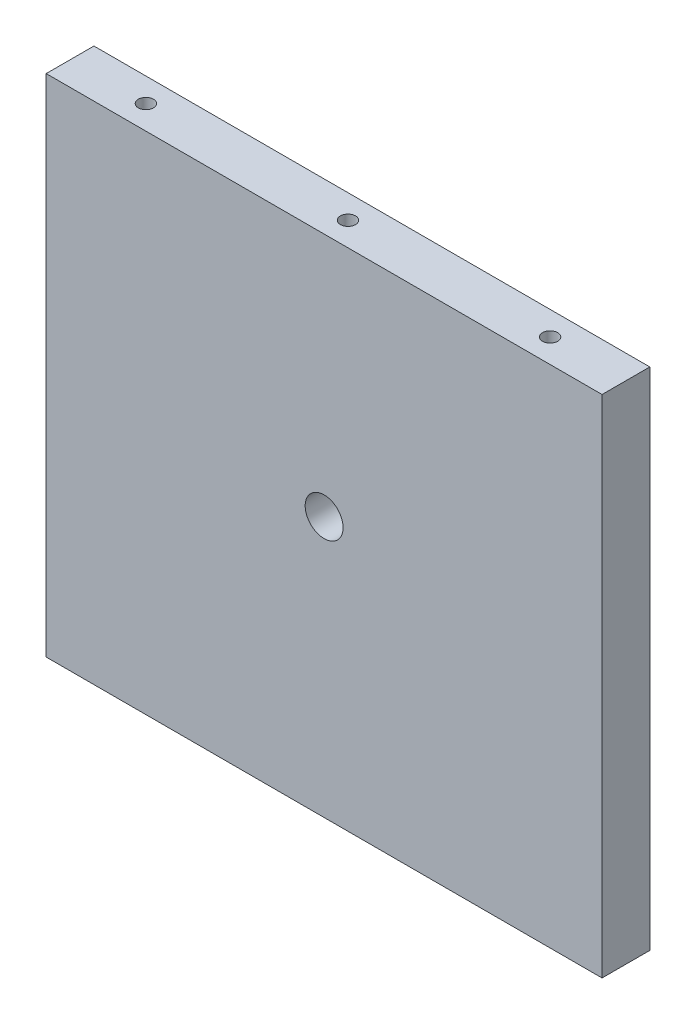
from build123d import *

# Parameters (mm, degrees)
SKETCH1_W                           = 139.7
SKETCH1_H                           = 127
SKETCH1_R                           = 4.7625
BOSS_EXTRUDE1_DEPTH                 = 12
TAP_DRILL_FOR_10_24_TAP1_AT_2_COUNT = 2
TAP_DRILL_FOR_10_24_TAP1_AT_2_PITCH = 50.8
TAP_DRILL_FOR_10_24_TAP1_AT_3_COUNT = 2
TAP_DRILL_FOR_10_24_TAP1_AT_3_PITCH = 101.6


with BuildPart() as part:
    # Sketch1 → Boss-Extrude1 (new body)
    with BuildSketch(Plane.XY):
        with Locations((0, 12.7)):
            Rectangle(SKETCH1_W, SKETCH1_H)
        with Locations((0, 14.67)):
            Circle(SKETCH1_R, mode=Mode.SUBTRACT)
    extrude(amount=BOSS_EXTRUDE1_DEPTH)

    # Sketch4 → Tap Drill for #10-24 Tap1 (revolve, cut)
    with BuildSketch(Plane(origin=(50.8, -50.8, 6), x_dir=(0, 0, -1), z_dir=(1, 0, 0))):
        Polygon((0, 0), (0, 13.840824014), (1.89865, 12.7), (1.89865, 0), align=None)
    tap_drill_for_10_24_tap1 = revolve(axis=Axis((50.8, -57.15, 6), (0, 1, 0)), mode=Mode.SUBTRACT)

    # Tap Drill for #10-24 Tap1 at 2: Tap Drill for #10-24 Tap1 ×2
    with Locations(*[(-i * TAP_DRILL_FOR_10_24_TAP1_AT_2_PITCH, 0, 0) for i in range(1, TAP_DRILL_FOR_10_24_TAP1_AT_2_COUNT)]):
        add(tap_drill_for_10_24_tap1, mode=Mode.SUBTRACT)

    # Tap Drill for #10-24 Tap1 at 3: Tap Drill for #10-24 Tap1 ×2
    with Locations(*[(-i * TAP_DRILL_FOR_10_24_TAP1_AT_3_PITCH, 0, 0) for i in range(1, TAP_DRILL_FOR_10_24_TAP1_AT_3_COUNT)]):
        add(tap_drill_for_10_24_tap1, mode=Mode.SUBTRACT)

    # Mirror1: Tap Drill for #10-24 Tap1 across plane
    add(tap_drill_for_10_24_tap1.mirror(Plane(origin=(0, 12.7, 0), x_dir=(0, 0, 1), z_dir=(0, -1, 0))), mode=Mode.SUBTRACT)

    # Mirror1 copy 1 sketch → Mirror1 copy 1 (revolve, cut)
    with BuildSketch(Plane(origin=(0, 76.2, 6), x_dir=(0, 0, -1), z_dir=(1, 0, 0))):
        Polygon((0, 0), (0, -13.840824014), (1.89865, -12.7), (1.89865, 0), align=None)
    revolve(axis=Axis((0, 82.55, 6), (0, 1, 0)), mode=Mode.SUBTRACT)

    # Mirror1 copy 2 sketch → Mirror1 copy 2 (revolve, cut)
    with BuildSketch(Plane(origin=(-50.8, 76.2, 6), x_dir=(0, 0, -1), z_dir=(1, 0, 0))):
        Polygon((0, 0), (0, -13.840824014), (1.89865, -12.7), (1.89865, 0), align=None)
    revolve(axis=Axis((-50.8, 82.55, 6), (0, 1, 0)), mode=Mode.SUBTRACT)


solid = part.part
